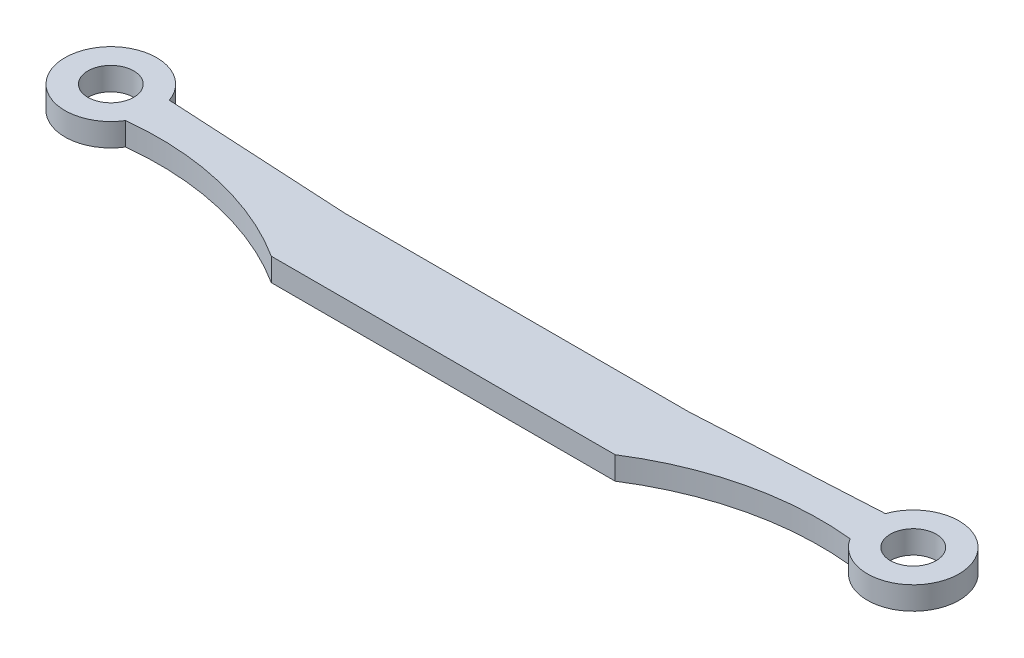
from build123d import *

# Parameters (mm, degrees)
SKETCH1_R           = 4
SKETCH1_R_2         = 2
BOSS_EXTRUDE1_DEPTH = 2
SKETCH3_W           = 40.799195599
SKETCH3_H           = 10.791683918
CUT_EXTRUDE1_DEPTH  = 10
SKETCH4_W           = 4.995
SKETCH4_H           = 6.450932821
BOSS_EXTRUDE2_DEPTH = 2


with BuildPart() as part:
    # Sketch1 → Boss-Extrude1 (new body)
    # profile 1 of 3: a face of its own
    with BuildSketch(Plane(origin=(0, 0, 0), x_dir=(1, 0, 0), z_dir=(0, 1, 0))):
        with BuildLine():
            ThreePointArc((26.59659241, -6.101622416), (26.022594709, -4.424555239), (26.229666852, -2.664115292))
            Line((26.229666852, -2.664115292), (10, -3.549067179))
            Line((10, -3.549067179), (-10, -3.549067179))
            Line((-10, -3.549067179), (-26.229666852, -2.664115292))
            ThreePointArc((-26.229666852, -2.664115292), (-26.057834821, -3.32225838), (-26, -4))
            ThreePointArc((-26, -4), (-26.152037529, -5.092329996), (-26.59659241, -6.101622416))
            ThreePointArc((-26.59659241, -6.101622416), (-17.96712489, -6.640913059), (-10, -10))
            Line((-10, -10), (10, -10))
            ThreePointArc((10, -10), (17.96712489, -6.640913059), (26.59659241, -6.101622416))
        make_face()
    # profile 2 of 3: a face of its own
    with BuildSketch(Plane(origin=(0, 0, 0), x_dir=(1, 0, 0), z_dir=(0, 1, 0))):
        with Locations((-30, -4)):
            Circle(SKETCH1_R)
        with Locations(Location((-30, -4, 0), (0, 0, 270))):
            Circle(SKETCH1_R_2, mode=Mode.SUBTRACT)
    # profile 3 of 3: a face of its own
    with BuildSketch(Plane(origin=(0, 0, 0), x_dir=(1, 0, 0), z_dir=(0, 1, 0))):
        with Locations((30, -4)):
            Circle(SKETCH1_R)
        with Locations(Location((30, -4, 0), (0, 0, 270))):
            Circle(SKETCH1_R_2, mode=Mode.SUBTRACT)
    extrude(amount=BOSS_EXTRUDE1_DEPTH)

    # Sketch3 → Cut-Extrude1 (cut)
    with BuildSketch(Plane(origin=(0, 2, 0), x_dir=(1, 0, 0), z_dir=(0, 1, 0))):
        with Locations((-20.3995978, -4.604158041)):
            Rectangle(SKETCH3_W, SKETCH3_H)
    extrude(amount=-CUT_EXTRUDE1_DEPTH, mode=Mode.SUBTRACT)

    # Sketch4 → Boss-Extrude2 (add)
    with BuildSketch(Plane(origin=(0, 2, 0), x_dir=(1, 0, 0), z_dir=(0, 1, 0))):
        with Locations((-2.4975, -6.774533589)):
            Rectangle(SKETCH4_W, SKETCH4_H)
    extrude(amount=-BOSS_EXTRUDE2_DEPTH)

    # Mirror3: part across plane


with BuildPart() as part_1:
    add(part.part)
    add(part.part.mirror(Plane.ZY.offset(4.995)))


solid = part_1.part
